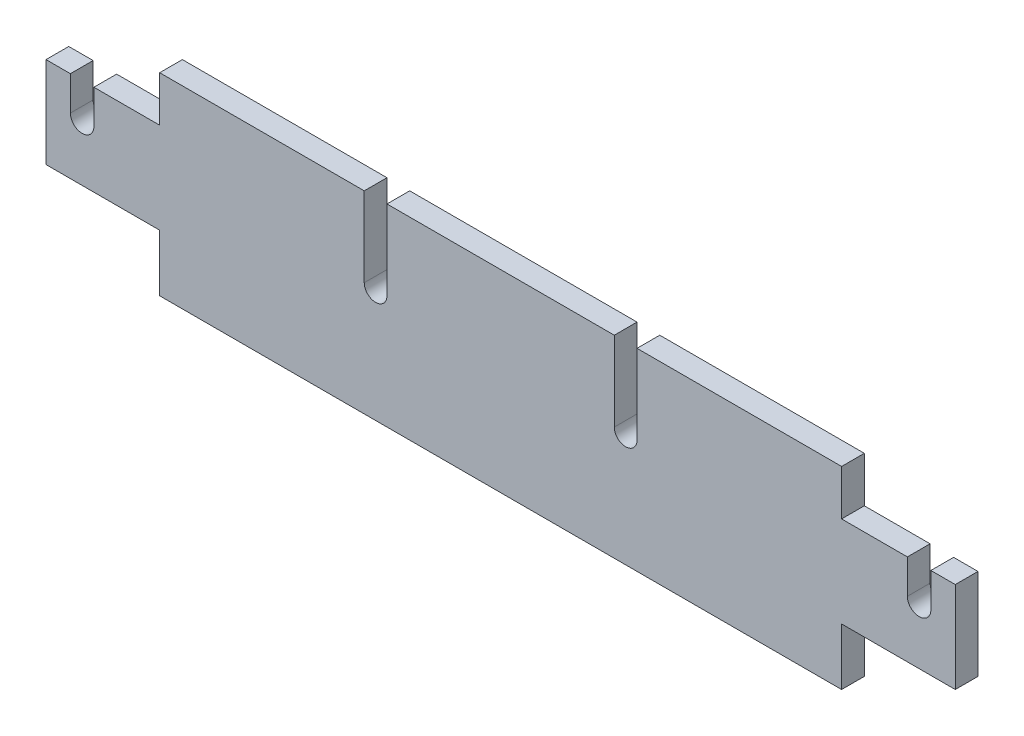
from build123d import *

# Parameters (mm, degrees)
RESSALTO_EXTRUS_O1_DEPTH = 2


with BuildPart() as part:
    # Esboço1 → Ressalto-extrusão1 (new body)
    with BuildSketch(Plane.XY):
        with BuildLine():
            Line((-30, 5), (-30, 0))
            Line((-30, 0), (30, 0))
            Line((30, 0), (30, 5))
            Line((30, 5), (40, 5))
            Line((40, 5), (40, 13))
            Line((40, 13), (37.853679508, 13))
            Line((37.853679508, 13), (37.853679508, 10))
            ThreePointArc((37.853679508, 10), (36.820223821, 8.966544314), (35.786768135, 10))
            Line((35.786768135, 10), (35.786768135, 13))
            Line((35.786768135, 13), (30, 13))
            Line((30, 13), (30, 17))
            Line((30, 17), (12, 17))
            Line((12, 17), (12, 10))
            ThreePointArc((12, 10), (11, 9), (10, 10))
            Line((10, 10), (10, 17))
            Line((10, 17), (-10, 17))
            Line((-10, 17), (-10, 10))
            ThreePointArc((-10, 10), (-11, 9), (-12, 10))
            Line((-12, 10), (-12, 17))
            Line((-12, 17), (-30, 17))
            Line((-30, 17), (-30, 13))
            Line((-30, 13), (-35.786768135, 13))
            Line((-35.786768135, 13), (-35.786768135, 10))
            ThreePointArc((-35.786768135, 10), (-36.820223821, 8.966544314), (-37.853679508, 10))
            Line((-37.853679508, 10), (-37.853679508, 13))
            Line((-37.853679508, 13), (-40, 13))
            Line((-40, 13), (-40, 5))
            Line((-40, 5), (-30, 5))
        make_face()
    extrude(amount=RESSALTO_EXTRUS_O1_DEPTH)


solid = part.part
